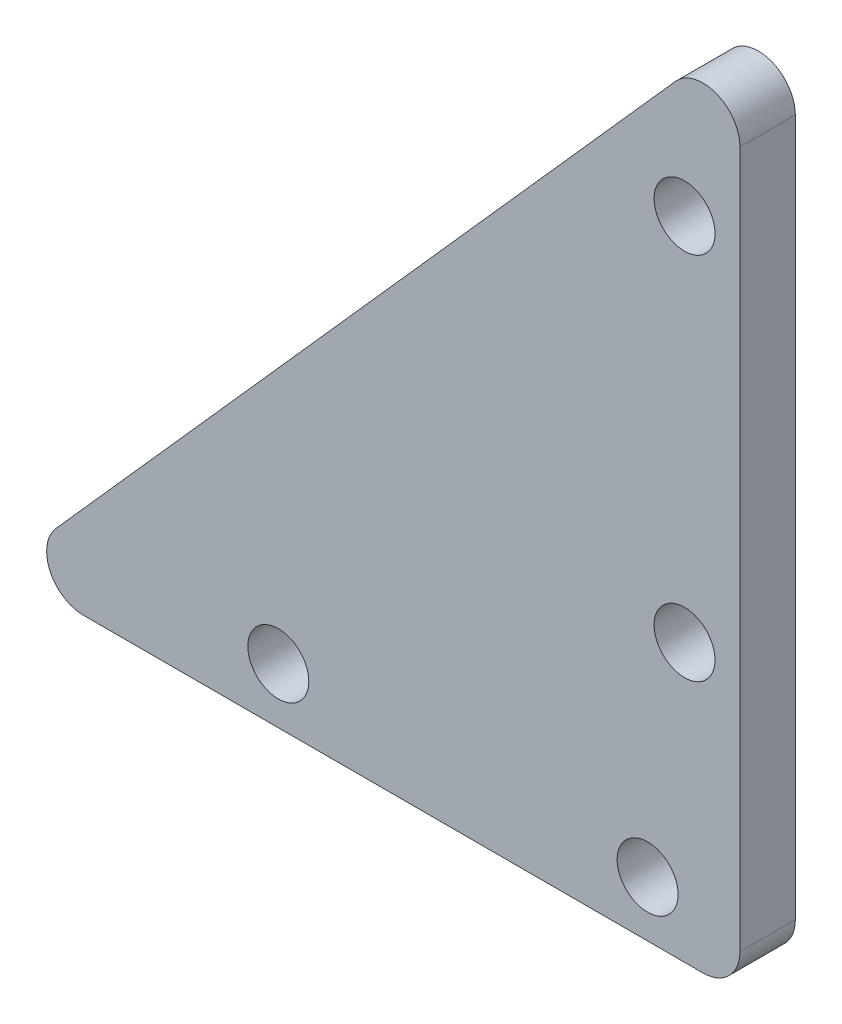
from build123d import *

# Parameters (mm, degrees)
EXTRUDE_1_DEPTH     = 3
SKETCH_2_R          = 1.65
CUT_EXTRUDE_1_DEPTH = 3
SKETCH_3_R          = 1.65
CUT_EXTRUDE_2_DEPTH = 3
FILLET_1_R          = 2


with BuildPart() as part:
    # 草图1 → 凸台-拉伸1 (new body)
    with BuildSketch(Plane.XY):
        Polygon((0, 0), (-40, 0), (0, 45), align=None)
    extrude(amount=EXTRUDE_1_DEPTH)

    # 草图2 → 切除-拉伸1 (cut)
    with BuildSketch(Plane.XY.offset(3)):
        with Locations((-5, 3)):
            Circle(SKETCH_2_R)
        with Locations((-25, 3)):
            Circle(SKETCH_2_R)
    extrude(amount=-CUT_EXTRUDE_1_DEPTH, mode=Mode.SUBTRACT)

    # 草图3 → 切除-拉伸2 (cut)
    with BuildSketch(Plane.XY.offset(3)):
        with Locations((-3, 15)):
            Circle(SKETCH_3_R)
        with Locations((-3, 35)):
            Circle(SKETCH_3_R)
    extrude(amount=-CUT_EXTRUDE_2_DEPTH, mode=Mode.SUBTRACT)

    # 圆角1
    fillet_1_edges = [part.edges().sort_by_distance(p)[0] for p in [
        (0, 0, 1.5),
        (-40, 0, 1.5),
        (0, 45, 1.5),
    ]]
    fillet(fillet_1_edges, radius=FILLET_1_R)


solid = part.part
